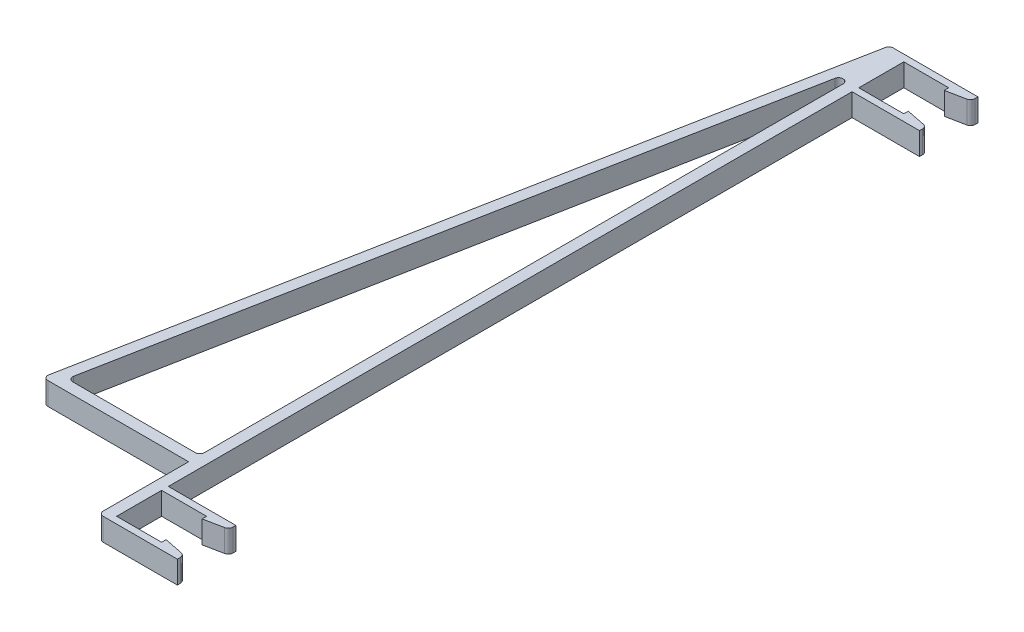
from build123d import *

# Parameters (mm, degrees)
EXTRUDE_1_DEPTH = 10
FILLET_1_R      = 2


with BuildPart() as part:
    # 草图1 → 凸台-拉伸1 (new body)
    with BuildSketch(Plane(origin=(0, 0, 0), x_dir=(1, 0, 0), z_dir=(0, 1, 0))):
        Polygon((-15, -175), (-15, -155), (5, -155), (5, -157), (15, -155), (15, -152), (-15, -152), (-15, 152), (15, 152), (15, 155), (5, 157), (5, 155), (-15, 155), (-15, 175), (5, 175), (5, 173), (15, 175), (15, 178), (-24.323280296, 178), (-85, -138), (-20, -138), (-20, -178), (15, -178), (15, -175), (5, -173), (5, -175), align=None)
        Polygon((-20, 174), (-20, -133), (-78.948585282, -133), align=None, mode=Mode.SUBTRACT)
    extrude(amount=EXTRUDE_1_DEPTH)

    # 圆角1
    fillet_1_edges = [part.edges().sort_by_distance(p)[0] for p in [
        (-24.323280296, 5, -178),
        (-85, 5, 138),
        (-20, 5, 178),
        (15, 5, 175),
        (15, 5, -155),
        (15, 5, -175),
        (-20, 5, -174),
        (-20, 5, 133),
        (-78.948585282, 5, 133),
        (15, 5, 155),
    ]]
    fillet(fillet_1_edges, radius=FILLET_1_R)


solid = part.part
